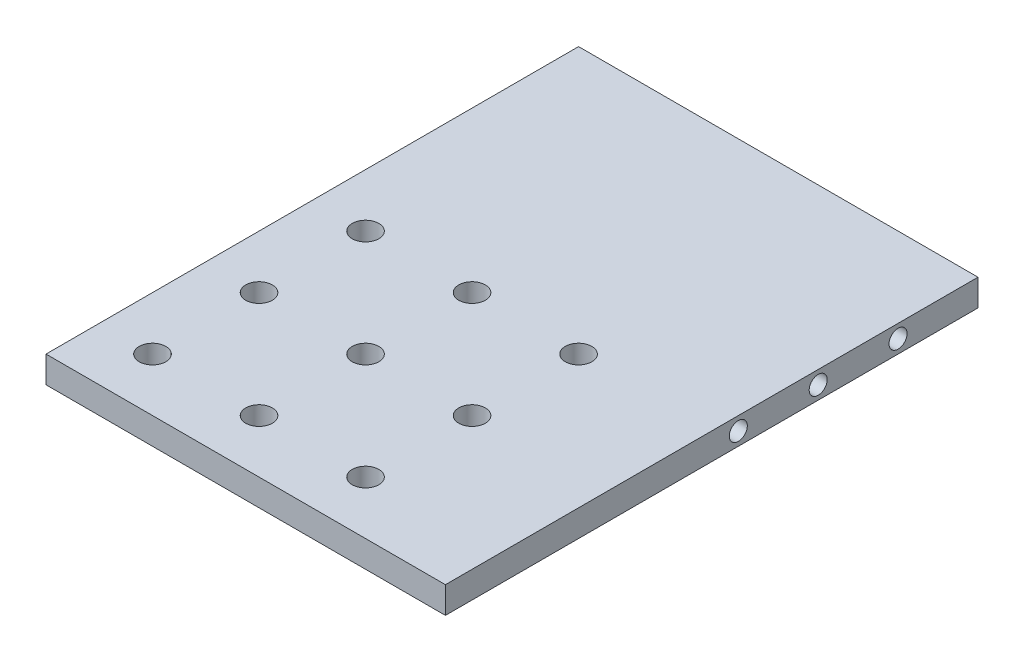
from build123d import *

# Parameters (mm, degrees)
SKETCH1_W           = 95.25
SKETCH1_H           = 127
SKETCH1_R           = 3.175
BOSS_EXTRUDE1_DEPTH = 6.35
SKETCH2_R           = 2.15265
CUT_EXTRUDE1_DEPTH  = 25.4


with BuildPart() as part:
    # Sketch1 → Boss-Extrude1 (new body)
    with BuildSketch(Plane(origin=(0, 0, 0), x_dir=(1, 0, 0), z_dir=(0, 1, 0))):
        Rectangle(SKETCH1_W, SKETCH1_H)
        with Locations(Location((-34.925, 0, 0), (0, 0, 270))):
            Circle(SKETCH1_R, mode=Mode.SUBTRACT)
        with Locations(Location((-9.525, 0, 0), (0, 0, 270))):
            Circle(SKETCH1_R, mode=Mode.SUBTRACT)
        with Locations(Location((15.875, 0, 0), (0, 0, 270))):
            Circle(SKETCH1_R, mode=Mode.SUBTRACT)
        with Locations(Location((-9.525, -25.4, 0), (0, 0, 270))):
            Circle(SKETCH1_R, mode=Mode.SUBTRACT)
        with Locations(Location((15.875, -25.4, 0), (0, 0, 270))):
            Circle(SKETCH1_R, mode=Mode.SUBTRACT)
        with Locations(Location((-9.525, -50.8, 0), (0, 0, 270))):
            Circle(SKETCH1_R, mode=Mode.SUBTRACT)
        with Locations(Location((15.875, -50.8, 0), (0, 0, 270))):
            Circle(SKETCH1_R, mode=Mode.SUBTRACT)
        with Locations(Location((-34.925, -25.4, 0), (0, 0, 270))):
            Circle(SKETCH1_R, mode=Mode.SUBTRACT)
        with Locations(Location((-34.925, -50.8, 0), (0, 0, 270))):
            Circle(SKETCH1_R, mode=Mode.SUBTRACT)
    extrude(amount=BOSS_EXTRUDE1_DEPTH)

    # Sketch2 → Cut-Extrude1 (cut)
    with BuildSketch(Plane(origin=(47.625, 0, 0), x_dir=(0, 0, -1), z_dir=(1, 0, 0))):
        with Locations((44.44238, 3.175)):
            Circle(SKETCH2_R)
        with Locations((25.39238, 3.175)):
            Circle(SKETCH2_R)
        with Locations((6.34238, 3.175)):
            Circle(SKETCH2_R)
    extrude(amount=-CUT_EXTRUDE1_DEPTH, mode=Mode.SUBTRACT)


solid = part.part
